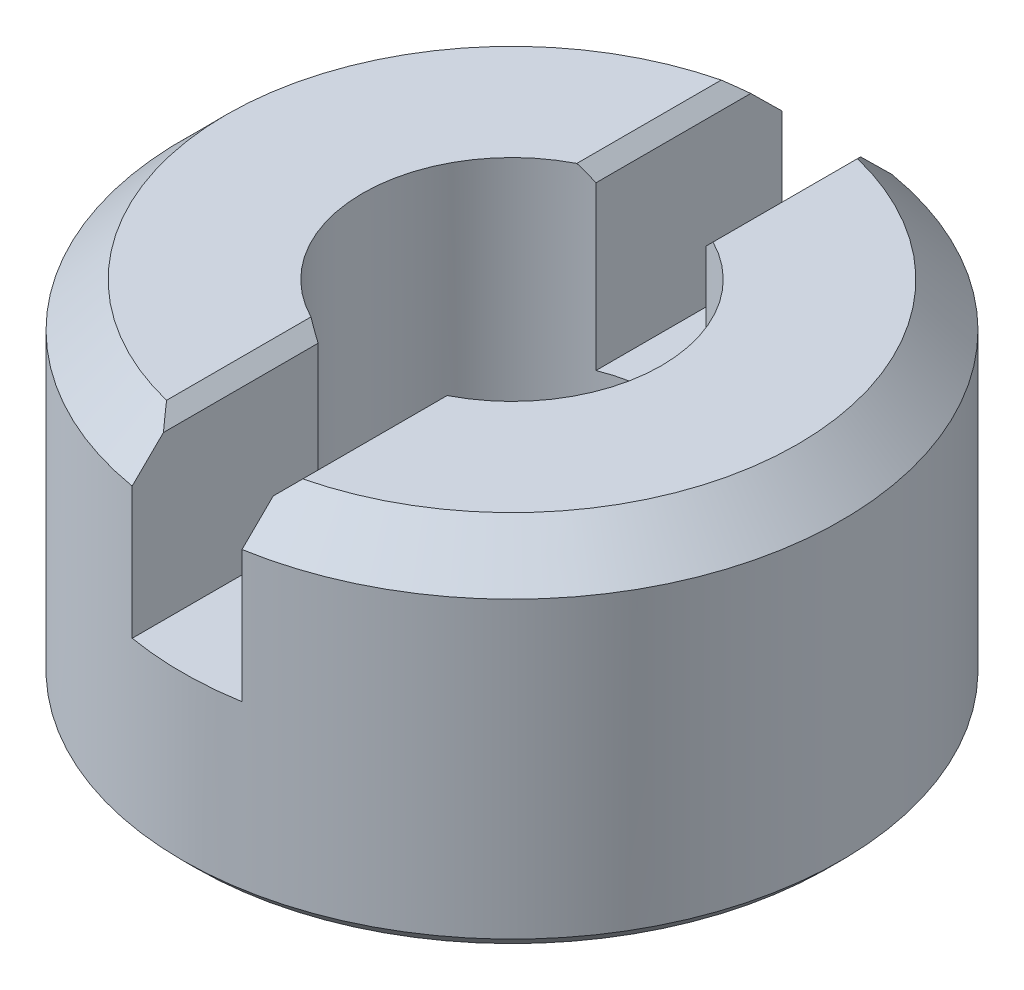
from build123d import *

# Parameters (mm, degrees)
SKICA1_R                 = 1.5
VYSUNOUT1_DEPTH          = 1.6
SKICA2_W                 = 0.5
SKICA2_H                 = 3
ODEBRAT_VYSUNUT_M2_DEPTH = 0.8
ZKOSIT1_SIZE             = 0.2
ZKOSIT3_SIZE             = 0.06
SKICA3_R                 = 0.68
ODEBRAT_VYSUNUT_M3_DEPTH = 3.657066051


with BuildPart() as part:
    # Skica1 → Vysunout1 (new body)
    with BuildSketch(Plane(origin=(0, 0, 0), x_dir=(1, 0, 0), z_dir=(0, 1, 0))):
        with Locations(Location((0, 0, 0), (0, 0, 270))):
            Circle(SKICA1_R)
    extrude(amount=VYSUNOUT1_DEPTH)

    # Skica2 → Odebrat vysunutím2 (cut)
    with BuildSketch(Plane(origin=(0, 1.6, 0), x_dir=(-1, 0, 0), z_dir=(0, 1, 0))):
        Rectangle(SKICA2_W, SKICA2_H)
    extrude(amount=-ODEBRAT_VYSUNUT_M2_DEPTH, mode=Mode.SUBTRACT)

    # Zkosit1
    zkosit1_edges = [part.edges().sort_by_distance(p)[0] for p in [
        (1.5, 1.6, 0),
        (-1.5, 1.6, 0),
    ]]
    chamfer(zkosit1_edges, length=ZKOSIT1_SIZE)

    # Zkosit3
    zkosit3_edges = [part.edges().sort_by_distance(p)[0] for p in [
        (0, 0, -1.5),
        (-0.25, 1.6, 0),
        (0.25, 1.6, 0),
    ]]
    chamfer(zkosit3_edges, length=ZKOSIT3_SIZE)

    # Skica3 → Odebrat vysunutím3 (cut, through all)
    with BuildSketch(Plane.XZ):
        with Locations(Location((0, 0, 0), (0, 0, 270))):
            Circle(SKICA3_R)
    extrude(amount=-ODEBRAT_VYSUNUT_M3_DEPTH, mode=Mode.SUBTRACT)

    # Skica4 → Odebrat otočením1 (revolve, cut)
    with BuildSketch(Plane.XY, mode=Mode.PRIVATE) as odebrat_oto_en_m1_sk:
        Polygon((-0.8, 0), (0, 0), (0, 0.461880215), align=None)
    revolve(odebrat_oto_en_m1_sk.sketch.rotate(Axis((0, 0, 0), (0, 1, 0)), 270), axis=Axis((0, 0, 0), (0, 1, 0)), mode=Mode.SUBTRACT)


solid = part.part
